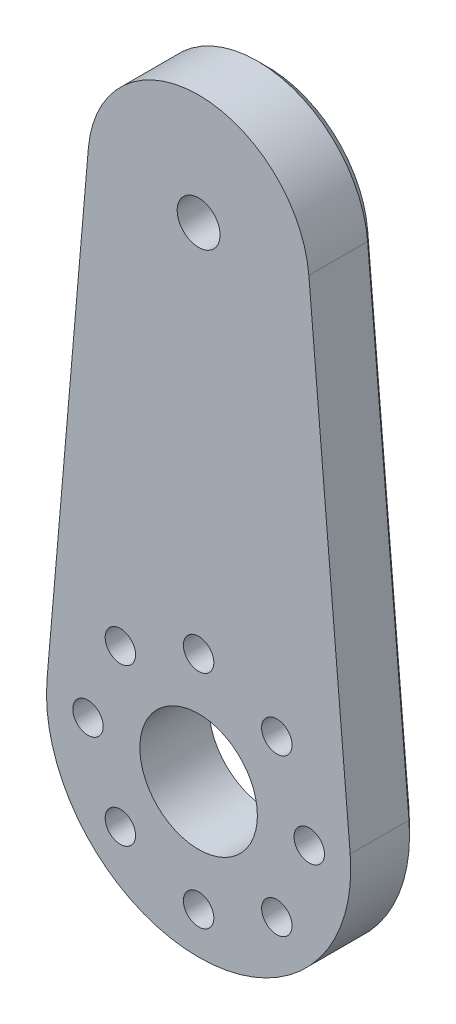
from build123d import *

# Parameters (mm, degrees)
SKETCH1_R           = 1.55
SKETCH1_R_2         = 4.25
SKETCH1_R_3         = 1.1
BOSS_EXTRUDE1_DEPTH = 5
CUT_EXTRUDE2_DEPTH  = 2
SKETCH4_R           = 1.75
CUT_EXTRUDE3_DEPTH  = 2.25
CHAFL_N1_SIZE       = 0.75


with BuildPart() as part:
    # Sketch1 → Boss-Extrude1 (new body)
    with BuildSketch(Plane.XY):
        with BuildLine():
            Line((-23.088186689, 16.318953541), (-26.077145964, -18.423903602))
            ThreePointArc((-26.077145964, -18.423903602), (-15.11762862, -30.366760745), (-4.158111277, -18.423903602))
            Line((-4.158111277, -18.423903602), (-7.147070552, 16.318953541))
            ThreePointArc((-7.147070552, 16.318953541), (-15.11762862, 23.633239255), (-23.088186689, 16.318953541))
        make_face()
        with Locations((-15.11762862, 15.633239255)):
            Circle(SKETCH1_R, mode=Mode.SUBTRACT)
        with Locations((-15.11762862, -19.366760745)):
            Circle(SKETCH1_R_2, mode=Mode.SUBTRACT)
        with Locations((-7.11762862, -19.366760745)):
            Circle(SKETCH1_R_3, mode=Mode.SUBTRACT)
        with Locations((-9.460774371, -25.023614994)):
            Circle(SKETCH1_R_3, mode=Mode.SUBTRACT)
        with Locations((-15.11762862, -27.366760745)):
            Circle(SKETCH1_R_3, mode=Mode.SUBTRACT)
        with Locations((-20.77448287, -25.023614994)):
            Circle(SKETCH1_R_3, mode=Mode.SUBTRACT)
        with Locations((-23.11762862, -19.366760745)):
            Circle(SKETCH1_R_3, mode=Mode.SUBTRACT)
        with Locations((-20.77448287, -13.709906495)):
            Circle(SKETCH1_R_3, mode=Mode.SUBTRACT)
        with Locations((-15.11762862, -11.366760745)):
            Circle(SKETCH1_R_3, mode=Mode.SUBTRACT)
        with Locations((-9.460774371, -13.709906495)):
            Circle(SKETCH1_R_3, mode=Mode.SUBTRACT)
    extrude(amount=BOSS_EXTRUDE1_DEPTH)

    # Sketch3 → Cut-Extrude2 (cut)
    with BuildSketch(Plane.XY):
        Polygon((-13.52991538, 12.883239255), (-11.94220214, 15.633239255), (-13.52991538, 18.383239255), (-16.705341861, 18.383239255), (-18.293055101, 15.633239255), (-16.705341861, 12.883239255), align=None)
    extrude(amount=CUT_EXTRUDE2_DEPTH, mode=Mode.SUBTRACT)

    # Sketch4 → Cut-Extrude3 (cut)
    with BuildSketch(Plane(origin=(0, 0, 0), x_dir=(-1, 0, 0), z_dir=(0, 0, -1))):
        with Locations((23.11762862, -19.366760745)):
            Circle(SKETCH4_R)
        with Locations((20.77448287, -25.023614994)):
            Circle(SKETCH4_R)
        with Locations((15.11762862, -27.366760745)):
            Circle(SKETCH4_R)
        with Locations((9.460774371, -25.023614994)):
            Circle(SKETCH4_R)
        with Locations((7.11762862, -19.366760745)):
            Circle(SKETCH4_R)
        with Locations((9.460774371, -13.709906495)):
            Circle(SKETCH4_R)
        with Locations((15.11762862, -11.366760745)):
            Circle(SKETCH4_R)
        with Locations((20.77448287, -13.709906495)):
            Circle(SKETCH4_R)
    extrude(amount=-CUT_EXTRUDE3_DEPTH, mode=Mode.SUBTRACT)

    # Chaflán1
    chafl_n1_edges = [part.edges().sort_by_distance(p)[0] for p in [
        (-5.652590914, -1.05247503, 0),
        (-15.11762862, -30.366760745, 0),
        (-24.582666326, -1.05247503, 0),
        (-15.11762862, 23.633239255, 0),
    ]]
    chamfer(chafl_n1_edges, length=CHAFL_N1_SIZE)


solid = part.part
